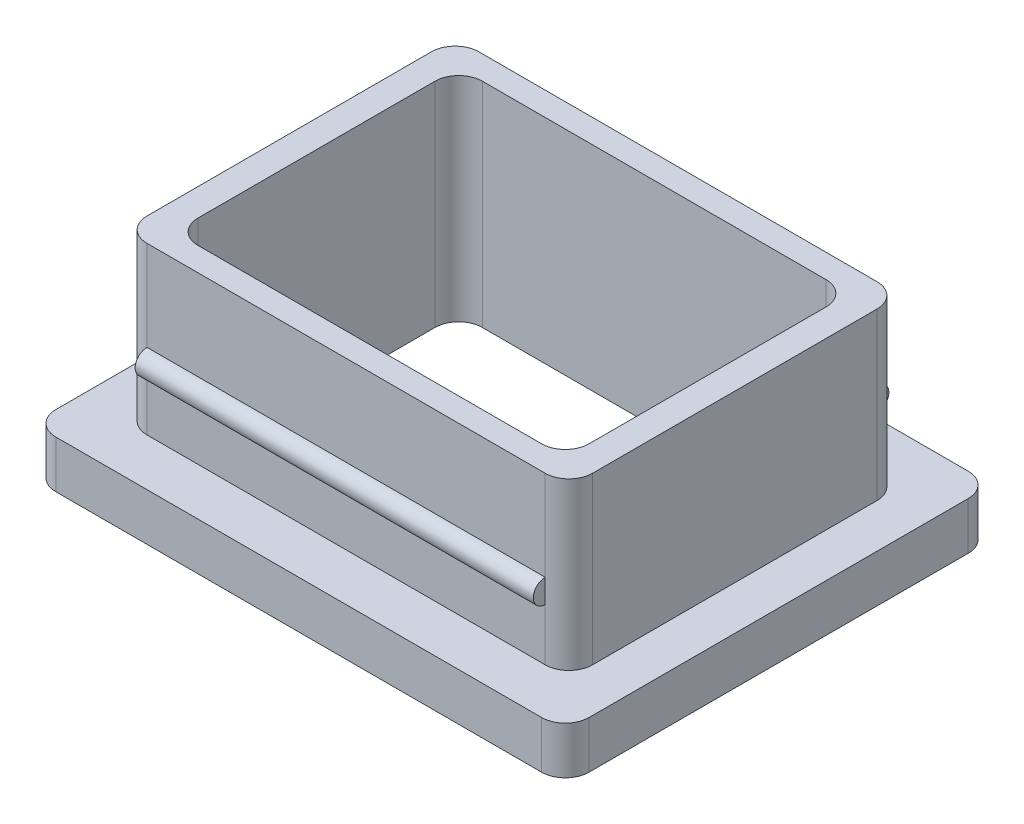
from build123d import *

# Parameters (mm, degrees)
SKETCH1_W           = 18.8
SKETCH1_H           = 14
SKETCH1_W_2         = 16.5
SKETCH1_H_2         = 12
BOSS_EXTRUDE1_DEPTH = 7
SKETCH2_W           = 22.5
SKETCH2_H           = 18
SKETCH2_W_2         = 18.8
SKETCH2_H_2         = 14
SKETCH2_W_3         = 16.5
SKETCH2_H_3         = 12
BOSS_EXTRUDE2_DEPTH = 2
FILLET2_R           = 1
BOSS_EXTRUDE6_DEPTH = 16.8


with BuildPart() as part:
    # Sketch1 → Boss-Extrude1 (new body)
    with BuildSketch(Plane(origin=(0, 0, 0), x_dir=(1, 0, 0), z_dir=(0, 1, 0))):
        Rectangle(SKETCH1_W, SKETCH1_H)
        Rectangle(SKETCH1_W_2, SKETCH1_H_2, mode=Mode.SUBTRACT)
    extrude(amount=BOSS_EXTRUDE1_DEPTH)

    # Sketch2 → Boss-Extrude2 (add)
    # profile 1 of 2: a face of its own
    with BuildSketch(Plane(origin=(0, 0, 0), x_dir=(1, 0, 0), z_dir=(0, 1, 0))):
        Rectangle(SKETCH2_W, SKETCH2_H)
        Rectangle(SKETCH2_W_2, SKETCH2_H_2, mode=Mode.SUBTRACT)
    # profile 2 of 2: a face of its own
    with BuildSketch(Plane(origin=(0, 0, 0), x_dir=(1, 0, 0), z_dir=(0, 1, 0))):
        Rectangle(SKETCH2_W_2, SKETCH2_H_2)
        Rectangle(SKETCH2_W_3, SKETCH2_H_3, mode=Mode.SUBTRACT)
    extrude(amount=-BOSS_EXTRUDE2_DEPTH)

    # Fillet2
    fillet2_edges = [part.edges().sort_by_distance(p)[0] for p in [
        (8.25, 2.5, 6),
        (8.25, 2.5, -6),
        (-8.25, 2.5, -6),
        (-8.25, 2.5, 6),
        (11.25, -1, -9),
        (11.25, -1, 9),
        (-11.25, -1, 9),
        (-11.25, -1, -9),
        (9.4, 3.5, 7),
        (-9.4, 3.5, 7),
        (-9.4, 3.5, -7),
        (9.4, 3.5, -7),
    ]]
    fillet(fillet2_edges, radius=FILLET2_R)

    # Sketch7 → Boss-Extrude6 (add)
    with BuildSketch(Plane(origin=(-8.4, 0, 0), x_dir=(0, 0, -1), z_dir=(1, 0, 0))):
        with BuildLine():
            ThreePointArc((7, 3.2), (6.5, 2.7), (7, 2.2))
            Line((7, 2.2), (7, 3.2))
        make_face()
        with BuildLine():
            Line((7, 3.2), (7, 2.2))
            ThreePointArc((7, 2.2), (7.353553391, 2.346446609), (7.5, 2.7))
            ThreePointArc((7.5, 2.7), (7.353553391, 3.053553391), (7, 3.2))
        make_face()
        with BuildLine():
            ThreePointArc((-7, 3.2), (-7.5, 2.7), (-7, 2.2))
            Line((-7, 2.2), (-7, 3.2))
        make_face()
        with BuildLine():
            Line((-7, 3.2), (-7, 2.2))
            ThreePointArc((-7, 2.2), (-6.646446609, 2.346446609), (-6.5, 2.7))
            ThreePointArc((-6.5, 2.7), (-6.646446609, 3.053553391), (-7, 3.2))
        make_face()
    extrude(amount=BOSS_EXTRUDE6_DEPTH)


solid = part.part
